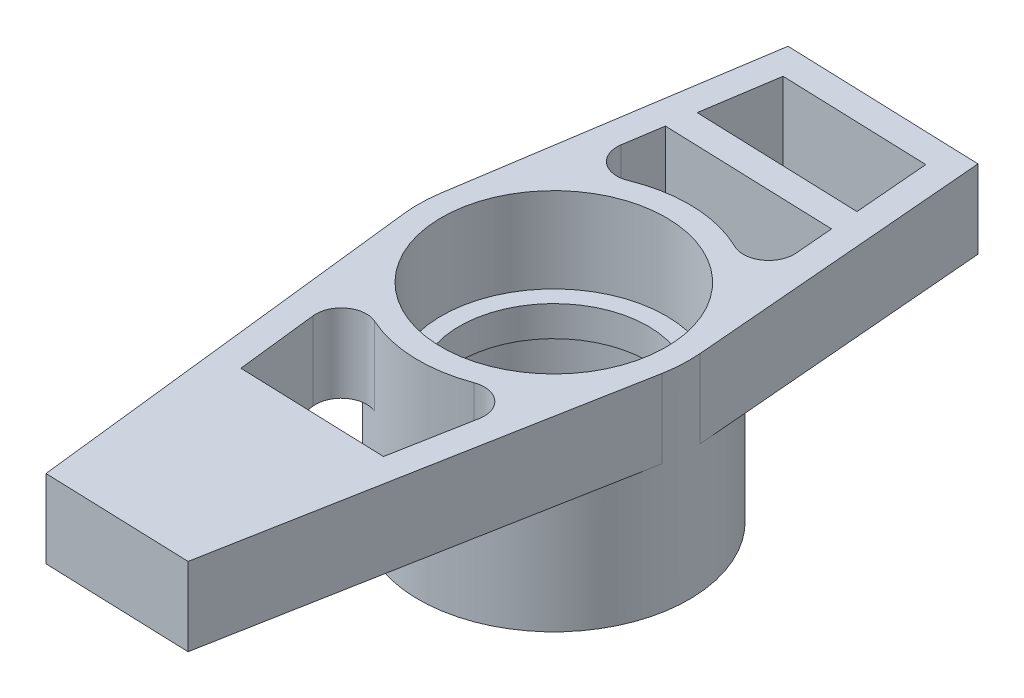
from build123d import *

# Parameters (mm, degrees)
MAIN_BODY_R         = 37.34054
MAIN_BODY_R_2       = 30.99054
MAIN_BODY_R_3       = 26.03754
BOSS_EXTRUDE1_DEPTH = 57.15
MAIN_BODY_5_R       = 30.99054
MAIN_BODY_5_R_2     = 26.03754
CUT_EXTRUDE2_DEPTH  = 23.495
CUT_EXTRUDE3_START  = 31.877
MAIN_BODY_6_R       = 30.99054
MAIN_BODY_6_R_2     = 26.03754
CUT_EXTRUDE3_DEPTH  = 25.273
BOSS_EXTRUDE2_DEPTH = 21.59
BOSS_EXTRUDE3_DEPTH = 21.59


with BuildPart() as part:
    # Main Body → Boss-Extrude1 (new body)
    # profile 1 of 2: a face of its own
    with BuildSketch(Plane(origin=(0, -10.541, 0), x_dir=(-1, 0, 0), z_dir=(0, -1, 0))):
        with Locations(Location((0, 0, 0), (0, 0, 90))):
            Circle(MAIN_BODY_R)
        Circle(MAIN_BODY_R_2, mode=Mode.SUBTRACT)
    # profile 2 of 2: a face of its own
    with BuildSketch(Plane(origin=(0, -10.541, 0), x_dir=(-1, 0, 0), z_dir=(0, -1, 0))):
        Circle(MAIN_BODY_R_2)
        with Locations(Location((0, 0, 0), (0, 0, 90))):
            Circle(MAIN_BODY_R_3, mode=Mode.SUBTRACT)
    extrude(amount=BOSS_EXTRUDE1_DEPTH)

    # Main Body<5> → Cut-Extrude2 (cut)
    with BuildSketch(Plane(origin=(0, -10.541, 0), x_dir=(-1, 0, 0), z_dir=(0, -1, 0))):
        with Locations(Location((0, 0, 0), (0, 0, 90))):
            Circle(MAIN_BODY_5_R)
        with Locations(Location((0, 0, 0), (0, 0, 90))):
            Circle(MAIN_BODY_5_R_2, mode=Mode.SUBTRACT)
    extrude(amount=CUT_EXTRUDE2_DEPTH, mode=Mode.SUBTRACT)

    # Main Body<6> → Cut-Extrude3 (cut)
    with BuildSketch(Plane(origin=(0, -10.541, 0), x_dir=(-1, 0, 0), z_dir=(0, -1, 0)).offset(CUT_EXTRUDE3_START)):
        with Locations(Location((0, 0, 0), (0, 0, 90))):
            Circle(MAIN_BODY_6_R)
        with Locations(Location((0, 0, 0), (0, 0, 90))):
            Circle(MAIN_BODY_6_R_2, mode=Mode.SUBTRACT)
    extrude(amount=CUT_EXTRUDE3_DEPTH, mode=Mode.SUBTRACT)

    # Main Body<7> → Boss-Extrude2 (add)
    # profile 1 of 3: a face of its own
    with BuildSketch(Plane(origin=(0, -10.541, 0), x_dir=(-1, 0, 0), z_dir=(0, -1, 0))):
        with BuildLine():
            ThreePointArc((14.04286423, 34.599333689), (23.506970789, 33.71138504), (31.892042271, 38.188922533))
            Line((31.892042271, 38.188922533), (24.09649432, 88.732685748))
            Line((24.09649432, 88.732685748), (-30.227475734, 86.835650912))
            Line((-30.227475734, 86.835650912), (-34.657917418, 33.717474684))
            ThreePointArc((-34.657917418, 33.717474684), (-25.561615202, 31.465837631), (-16.422184031, 33.535470761))
            ThreePointArc((-16.422184031, 33.535470761), (-23.434260482, 34.041037689), (-26.454981852, 40.389270237))
            Line((-26.454981852, 40.389270237), (-25.562757718, 51.086469788))
            Line((-25.562757718, 51.086469788), (21.936876136, 52.745193552))
            Line((21.936876136, 52.745193552), (23.573125777, 42.136290252))
            ThreePointArc((23.573125777, 42.136290252), (21.002593049, 35.592806809), (14.04286423, 34.599333689))
        make_face()
        Polygon((17.597375259, 80.881086782), (20.76719935, 60.328992267), (-24.924949261, 58.733387277), (-23.196488344, 79.456533674), align=None, mode=Mode.SUBTRACT)
    # profile 2 of 3: a face of its own
    with BuildSketch(Plane(origin=(0, -10.541, 0), x_dir=(-1, 0, 0), z_dir=(0, -1, 0))):
        with BuildLine():
            ThreePointArc((14.04286423, 34.599333689), (29.288407022, 23.162580633), (36.904181225, 5.691865742))
            Line((36.904181225, 5.691865742), (31.892042271, 38.188922533))
            ThreePointArc((31.892042271, 38.188922533), (23.506970789, 33.71138504), (14.04286423, 34.599333689))
        make_face()
    # profile 3 of 3: a face of its own
    with BuildSketch(Plane(origin=(0, -10.541, 0), x_dir=(-1, 0, 0), z_dir=(0, -1, 0))):
        with BuildLine():
            ThreePointArc((-37.211328977, 3.103695095), (-30.832801883, 21.063101755), (-16.422184031, 33.535470761))
            ThreePointArc((-16.422184031, 33.535470761), (-25.561615202, 31.465837631), (-34.657917418, 33.717474684))
            Line((-34.657917418, 33.717474684), (-37.211328977, 3.103695095))
        make_face()
    extrude(amount=BOSS_EXTRUDE2_DEPTH)

    # Main Body<8> → Boss-Extrude3 (add)
    with BuildSketch(Plane(origin=(0, -10.541, 0), x_dir=(-1, 0, 0), z_dir=(0, -1, 0))):
        with BuildLine():
            ThreePointArc((37.099808191, -4.233220956), (30.17838959, -21.990469055), (15.395357729, -34.01909593))
            ThreePointArc((15.395357729, -34.01909593), (22.38882917, -34.737546541), (25.215213948, -41.174654833))
            Line((25.215213948, -41.174654833), (22.643322984, -63.714622021))
            Line((22.643322984, -63.714622021), (-18.14365763, -65.138934769))
            Line((-18.14365763, -65.138934769), (-22.281592226, -42.833279853))
            ThreePointArc((-22.281592226, -42.833279853), (-19.911122354, -36.214693398), (-12.984803239, -35.010152989))
            ThreePointArc((-12.984803239, -35.010152989), (-28.570898972, -24.042039419), (-36.714140357, -6.810860839))
            Line((-36.714140357, -6.810860839), (-16.240572134, -117.174216531))
            Line((-16.240572134, -117.174216531), (24.374671076, -115.755900985))
            Line((24.374671076, -115.755900985), (37.099808191, -4.233220956))
        make_face()
    extrude(amount=BOSS_EXTRUDE3_DEPTH)


solid = part.part
